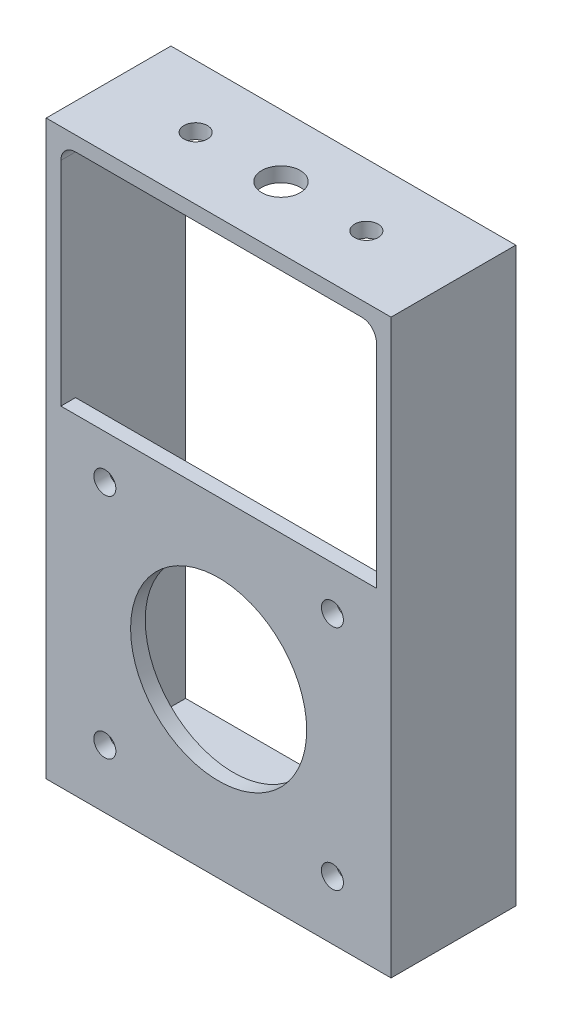
from build123d import *

# Parameters (mm, degrees)
SKETCH1_W           = 47
SKETCH1_H           = 78
SKETCH1_W_2         = 43
SKETCH1_H_2         = 74
EXTRUDE_THIN1_DEPTH = 15
SKETCH6_W           = 47
SKETCH6_H           = 78
BOSS_EXTRUDE1_DEPTH = 2
SKETCH8_W           = 43
SKETCH8_H           = 31
CUT_EXTRUDE1_DEPTH  = 10
CUT_EXTRUDE2_DEPTH  = 10
CUT_EXTRUDE3_DEPTH  = 10
CIRPATTERN1_COUNT   = 4
SKETCH12_R          = 1.6
CUT_EXTRUDE4_DEPTH  = 10
FILLET1_R           = 2


with BuildPart() as part:
    # Sketch1 → Extrude-Thin1 (new body)
    with BuildSketch(Plane.XY):
        with Locations((55.076537335, -3.402525622)):
            Rectangle(SKETCH1_W, SKETCH1_H)
        with Locations((55.076537335, -3.402525622)):
            Rectangle(SKETCH1_W_2, SKETCH1_H_2, mode=Mode.SUBTRACT)
    extrude(amount=EXTRUDE_THIN1_DEPTH)

    # Sketch6 → Boss-Extrude1 (add)
    with BuildSketch(Plane.XY.offset(15)):
        with Locations((55.076537335, -3.402525622)):
            Rectangle(SKETCH6_W, SKETCH6_H)
    extrude(amount=BOSS_EXTRUDE1_DEPTH)

    # Sketch8 → Cut-Extrude1 (cut)
    with BuildSketch(Plane(origin=(0, 0, 15), x_dir=(-1, 0, 0), z_dir=(0, 0, -1))):
        with Locations((-55.076537335, 18.097474378)):
            Rectangle(SKETCH8_W, SKETCH8_H)
    extrude(amount=-CUT_EXTRUDE1_DEPTH, mode=Mode.SUBTRACT)

    # Sketch9 → Cut-Extrude2 (cut)
    with BuildSketch(Plane(origin=(0, 0, 15), x_dir=(-1, 0, 0), z_dir=(0, 0, -1))):
        with BuildLine():
            ThreePointArc((-43.076537335, -18.902525622), (-43.989982945, -14.310324434), (-46.591255961, -10.417244248))
            Line((-46.591255961, -10.417244248), (-63.56181871, -27.387806996))
            ThreePointArc((-63.56181871, -27.387806996), (-50.484336147, -29.989080012), (-43.076537335, -18.902525622))
        make_face()
        with BuildLine():
            Line((-63.56181871, -27.387806996), (-46.591255961, -10.417244248))
            ThreePointArc((-46.591255961, -10.417244248), (-63.56181871, -10.417244248), (-63.56181871, -27.387806996))
        make_face()
    extrude(amount=-CUT_EXTRUDE2_DEPTH, mode=Mode.SUBTRACT)

    # Sketch11 → Cut-Extrude3 (cut)
    with BuildSketch(Plane(origin=(0, 0, 15), x_dir=(-1, 0, 0), z_dir=(0, 0, -1))):
        with BuildLine():
            ThreePointArc((-38.069685624, -3.395673911), (-38.183866325, -2.821648762), (-38.509025452, -2.335013739))
            Line((-38.509025452, -2.335013739), (-40.630345796, -4.456334083))
            ThreePointArc((-40.630345796, -4.456334083), (-38.995660475, -4.78149321), (-38.069685624, -3.395673911))
        make_face()
        with BuildLine():
            Line((-40.630345796, -4.456334083), (-38.509025452, -2.335013739))
            ThreePointArc((-38.509025452, -2.335013739), (-40.630345796, -2.335013739), (-40.630345796, -4.456334083))
        make_face()
    cut_extrude3 = extrude(amount=-CUT_EXTRUDE3_DEPTH, mode=Mode.SUBTRACT)

    # CirPattern1: Cut-Extrude3 ×4 about axis
    cirpattern1_axis = Axis((55.076537335, -18.902525622, 0), (0, 0, 1))
    for i in range(1, CIRPATTERN1_COUNT):
        add(cut_extrude3.rotate(cirpattern1_axis, i * 360 / CIRPATTERN1_COUNT), mode=Mode.SUBTRACT)

    # Sketch12 → Cut-Extrude4 (cut)
    with BuildSketch(Plane(origin=(0, 35.597474378, 0), x_dir=(1, 0, 0), z_dir=(0, 1, 0))):
        with BuildLine():
            ThreePointArc((55.076537335, -5.875), (52.451537335, -8.5), (55.076537335, -11.125))
            Line((55.076537335, -11.125), (55.076537335, -5.875))
        make_face()
        with BuildLine():
            Line((55.076537335, -5.875), (55.076537335, -11.125))
            ThreePointArc((55.076537335, -11.125), (56.932692636, -10.356155301), (57.701537335, -8.5))
            ThreePointArc((57.701537335, -8.5), (56.932692636, -6.643844699), (55.076537335, -5.875))
        make_face()
        with Locations(Location((43.446537335, -8.5, 0), (0, 0, 270))):
            Circle(SKETCH12_R)
        with Locations(Location((66.706537335, -8.5, 0), (0, 0, 270))):
            Circle(SKETCH12_R)
    extrude(amount=-CUT_EXTRUDE4_DEPTH, mode=Mode.SUBTRACT)

    # Fillet1
    fillet1_edges = [part.edges().sort_by_distance(p)[0] for p in [
        (33.576537335, 33.597474378, 8.5),
        (76.576537335, 33.597474378, 8.5),
    ]]
    fillet(fillet1_edges, radius=FILLET1_R)


solid = part.part
